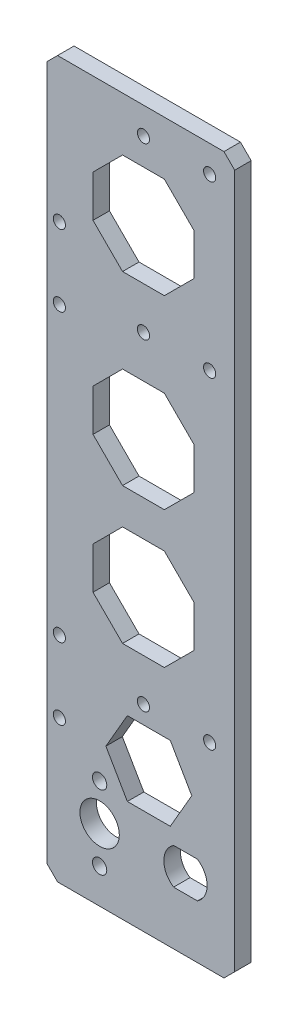
from build123d import *

# Parameters (mm, degrees)
CROQUIS1_W                   = 200
CROQUIS1_H                   = 52.5
SALIENTE_EXTRUIR1_DEPTH      = 4.6
CORTAR_EXTRUIR1_REACH        = 105.49
CORTAR_EXTRUIR2_REACH        = 105.49
CROQUIS3_R                   = 5.5
CROQUIS3_R_2                 = 2
TALADRO_DE_MARGEN_PARA_M31_D = 3.4
CHAFL_N1_SIZE                = 3
TALADRO_DE_MARGEN_PARA_M32_D = 3.4
CORTAR_EXTRUIR3_DEPTH        = 10


with BuildPart() as part:
    # Croquis1 → Saliente-Extruir1 (new body)
    with BuildSketch(Plane(origin=(0, 0, 0), x_dir=(0, 1, 0), z_dir=(0, 0, 1))):
        Rectangle(CROQUIS1_W, CROQUIS1_H)
    extrude(amount=SALIENTE_EXTRUIR1_DEPTH)

    # Croquis2 → Cortar-Extruir1 (cut, up to next)
    with BuildSketch(Plane.XY.offset(4.6), mode=Mode.PRIVATE) as cortar_extruir1_sk1:
        with BuildLine():
            Line((9.16833375, -74.95), (15.83166625, -74.95))
            ThreePointArc((15.83166625, -74.95), (18.55, -80), (15.83166625, -85.05))
            Line((15.83166625, -85.05), (9.16833375, -85.05))
            ThreePointArc((9.16833375, -85.05), (6.45, -80), (9.16833375, -74.95))
        make_face()
    cortar_extruir1_tool1 = extrude(cortar_extruir1_sk1.sketch, amount=-CORTAR_EXTRUIR1_REACH, mode=Mode.PRIVATE) & part.part
    add(cortar_extruir1_tool1.solids().sort_by_distance((12.5, -80, 4.6))[0], mode=Mode.SUBTRACT)

    # Croquis3 → Cortar-Extruir2 (cut, up to next)
    with BuildSketch(Plane.XY.offset(4.6), mode=Mode.PRIVATE) as cortar_extruir2_sk1:
        with Locations((-11.5, -80)):
            Circle(CROQUIS3_R)
    cortar_extruir2_tool1 = extrude(cortar_extruir2_sk1.sketch, amount=-CORTAR_EXTRUIR2_REACH, mode=Mode.PRIVATE) & part.part
    # Croquis3 → Cortar-Extruir2 (cut, up to next)
    with BuildSketch(Plane.XY.offset(4.6), mode=Mode.PRIVATE) as cortar_extruir2_sk2:
        with Locations((-11.5, -90.3)):
            Circle(CROQUIS3_R_2)
    cortar_extruir2_tool2 = extrude(cortar_extruir2_sk2.sketch, amount=-CORTAR_EXTRUIR2_REACH, mode=Mode.PRIVATE) & part.part
    # Croquis3 → Cortar-Extruir2 (cut, up to next)
    with BuildSketch(Plane.XY.offset(4.6), mode=Mode.PRIVATE) as cortar_extruir2_sk3:
        with Locations((-11.5, -69.7)):
            Circle(CROQUIS3_R_2)
    cortar_extruir2_tool3 = extrude(cortar_extruir2_sk3.sketch, amount=-CORTAR_EXTRUIR2_REACH, mode=Mode.PRIVATE) & part.part
    add(cortar_extruir2_tool1.solids().sort_by_distance((-11.5, -80, 4.6))[0], mode=Mode.SUBTRACT)
    add(cortar_extruir2_tool2.solids().sort_by_distance((-11.5, -90.3, 4.6))[0], mode=Mode.SUBTRACT)
    add(cortar_extruir2_tool3.solids().sort_by_distance((-11.5, -69.7, 4.6))[0], mode=Mode.SUBTRACT)

    # Taladro de margen para M31 (through all)
    with Locations(Plane(origin=(0, 0, 0), x_dir=(1, 0, 0), z_dir=(0, 0, -1))):
        with Locations((19.25, -45), (19.25, 45), (0.75, 45), (0.75, -45), (19.25, -92.5), (0.75, -92.5)):
            Hole(TALADRO_DE_MARGEN_PARA_M31_D / 2)

    # Chaflán1
    chafl_n1_edges = [part.edges().sort_by_distance(p)[0] for p in [
        (-26.25, 100, 2.3),
        (26.25, 100, 2.3),
        (26.25, -100, 2.3),
        (-26.25, -100, 2.3),
    ]]
    chamfer(chafl_n1_edges, length=CHAFL_N1_SIZE)

    # Taladro de margen para M32 (through all)
    with Locations(Plane.XY.offset(4.6)):
        with Locations((-22.75, -60), (-22.75, -40), (-22.75, 40), (-22.75, 60)):
            Hole(TALADRO_DE_MARGEN_PARA_M32_D / 2)

    # Croquis8 → Cortar-Extruir3 (cut)
    with BuildSketch(Plane(origin=(0, 0, 0), x_dir=(1, 0, 0), z_dir=(0, 0, -1))):
        Polygon((-5.090411229, 33.2), (-13.35, 24.940411229), (-13.35, 13.259588771), (-5.090411229, 5), (6.590411229, 5), (14.85, 13.259588771), (14.85, 24.940411229), (6.590411229, 33.2), align=None)
        Polygon((6.590411229, -33.2), (-5.090411229, -33.2), (-13.35, -24.940411229), (-13.35, -13.259588771), (-5.090411229, -5), (6.590411229, -5), (14.85, -13.259588771), (14.85, -24.940411229), align=None)
        Polygon((-5.090411229, -56.8), (-13.35, -65.059588771), (-13.35, -76.740411229), (-5.090411229, -85), (6.590411229, -85), (14.85, -76.740411229), (14.85, -65.059588771), (6.590411229, -56.8), align=None)
        Polygon((-3.749578543, 50), (8.249578543, 50), (14.249157087, 60.391574861), (8.249578543, 70.783149723), (-3.749578543, 70.783149723), (-9.749157087, 60.391574861), align=None)
    extrude(amount=-CORTAR_EXTRUIR3_DEPTH, mode=Mode.SUBTRACT)


solid = part.part
